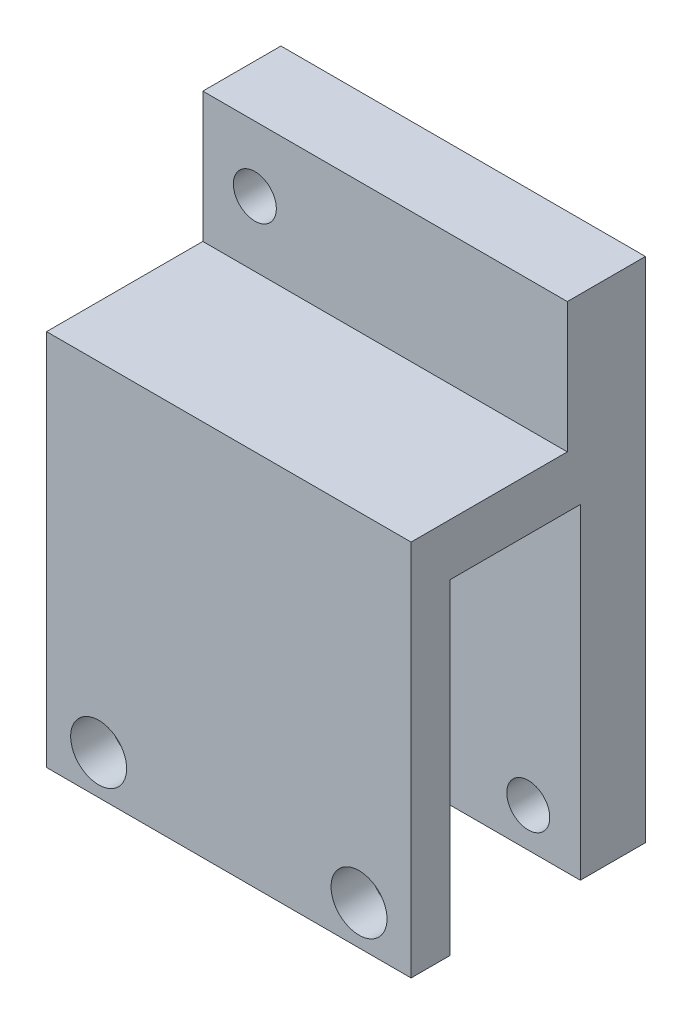
from build123d import *

# Parameters (mm, degrees)
EXTRUDE_1_DEPTH          = 14
HOLE_WIZARD_M4_1_D       = 3.3
HOLE_WIZARD_M4_2_D       = 3.3
HOLE_WIZARD_M4_2_DEPTH   = 5
HOLE_WIZARD_M4_1_2_D     = 4.3
HOLE_WIZARD_M4_1_2_DEPTH = 3


with BuildPart() as part:
    # 草图2 → 凸台-拉伸1 (new, symmetric)
    with BuildSketch(Plane(origin=(0, 0, 0), x_dir=(0, 0, -1), z_dir=(1, 0, 0))):
        Polygon((-15, 0), (-18, 0), (-18, 29), (-6, 29), (-6, 39), (0, 39), (0, 0), (-5, 0), (-5, 25), (-15, 25), align=None)
    extrude(amount=EXTRUDE_1_DEPTH, both=True)

    # Hole Wizard M4 _1 (through all)
    with Locations(Plane.XY.offset(6)):
        with Locations((-10, 34)):
            Hole(HOLE_WIZARD_M4_1_D / 2)

    # M4 螺纹孔2
    with Locations(Plane(origin=(0, 0, 0), x_dir=(-1, 0, 0), z_dir=(0, 0, -1))):
        with Locations((10, 3), (-10, 3)):
            Hole(HOLE_WIZARD_M4_2_D / 2, depth=HOLE_WIZARD_M4_2_DEPTH)

    # Hole Wizard M4 _1 2
    with Locations(Plane.XY.offset(18)):
        with Locations((-10, 3), (10, 3)):
            Hole(HOLE_WIZARD_M4_1_2_D / 2, depth=HOLE_WIZARD_M4_1_2_DEPTH)


solid = part.part
